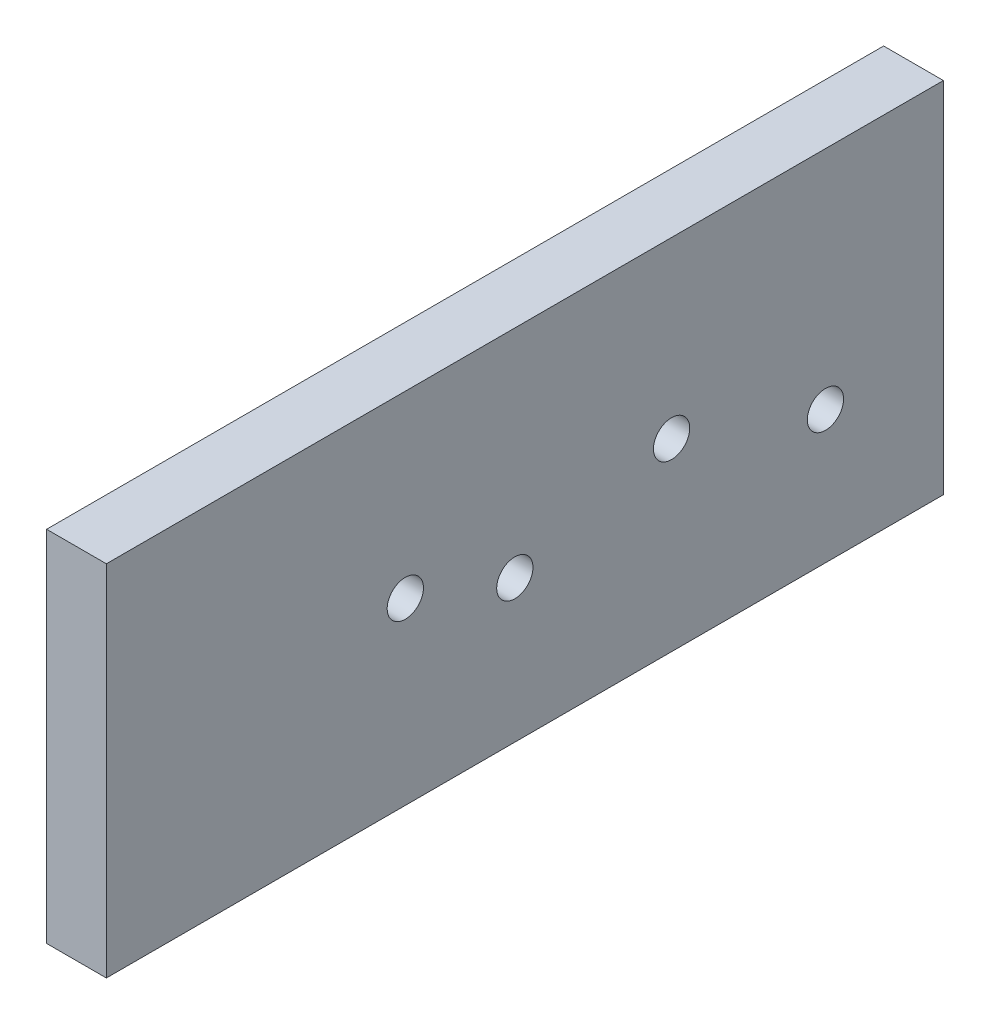
from build123d import *

# Parameters (mm, degrees)
SKETCH1_W                       = 177.8
SKETCH1_H                       = 76.2
SKETCH1_R                       = 3.854557775
BOSS_EXTRUDE1_DEPTH             = 12.7
F_1_4_0_25_DIAMETER_HOLE2_D     = 6.35
F_1_4_0_25_DIAMETER_HOLE2_DEPTH = 38.1
F_1_4_0_25_DIAMETER_HOLE2_TIP   = 1.907732465
SKETCH2_R                       = 7.9375
CUT_EXTRUDE1_DEPTH              = 5.08


with BuildPart() as part:
    # Sketch1 → Boss-Extrude1 (new body)
    with BuildSketch(Plane(origin=(0, 0, 0), x_dir=(0, 0, -1), z_dir=(1, 0, 0))):
        with Locations((-12.7, 0)):
            Rectangle(SKETCH1_W, SKETCH1_H)
        with Locations((18.457733582, 1.096077429)):
            Circle(SKETCH1_R, mode=Mode.SUBTRACT)
        with Locations((-38.1, 0)):
            Circle(SKETCH1_R, mode=Mode.SUBTRACT)
        with Locations((-14.836022013, -7.860160654)):
            Circle(SKETCH1_R, mode=Mode.SUBTRACT)
        with Locations((51.143457994, -9.873506971)):
            Circle(SKETCH1_R, mode=Mode.SUBTRACT)
    extrude(amount=BOSS_EXTRUDE1_DEPTH)

    # 1/4 (0.25) Diameter Hole2
    with Locations(Plane.XZ.offset(38.1)):
        with Locations((6.35, 57.15), (6.35, -63.5), (6.35, 0)):
            Hole(F_1_4_0_25_DIAMETER_HOLE2_D / 2, depth=F_1_4_0_25_DIAMETER_HOLE2_DEPTH)
            with Locations((0, 0, -(F_1_4_0_25_DIAMETER_HOLE2_DEPTH + F_1_4_0_25_DIAMETER_HOLE2_TIP / 2))):  # 118° drill point
                Cone(0, F_1_4_0_25_DIAMETER_HOLE2_D / 2, F_1_4_0_25_DIAMETER_HOLE2_TIP, mode=Mode.SUBTRACT)

    # Sketch2 → Cut-Extrude1 (cut)
    with BuildSketch(Plane.ZY):
        with Locations((38.1, 0)):
            Circle(SKETCH2_R)
        with Locations((14.836022013, -7.860160654)):
            Circle(SKETCH2_R)
        with Locations((-18.457733582, 1.096077429)):
            Circle(SKETCH2_R)
        with Locations((-51.143457994, -9.873506971)):
            Circle(SKETCH2_R)
    extrude(amount=-CUT_EXTRUDE1_DEPTH, mode=Mode.SUBTRACT)


solid = part.part
